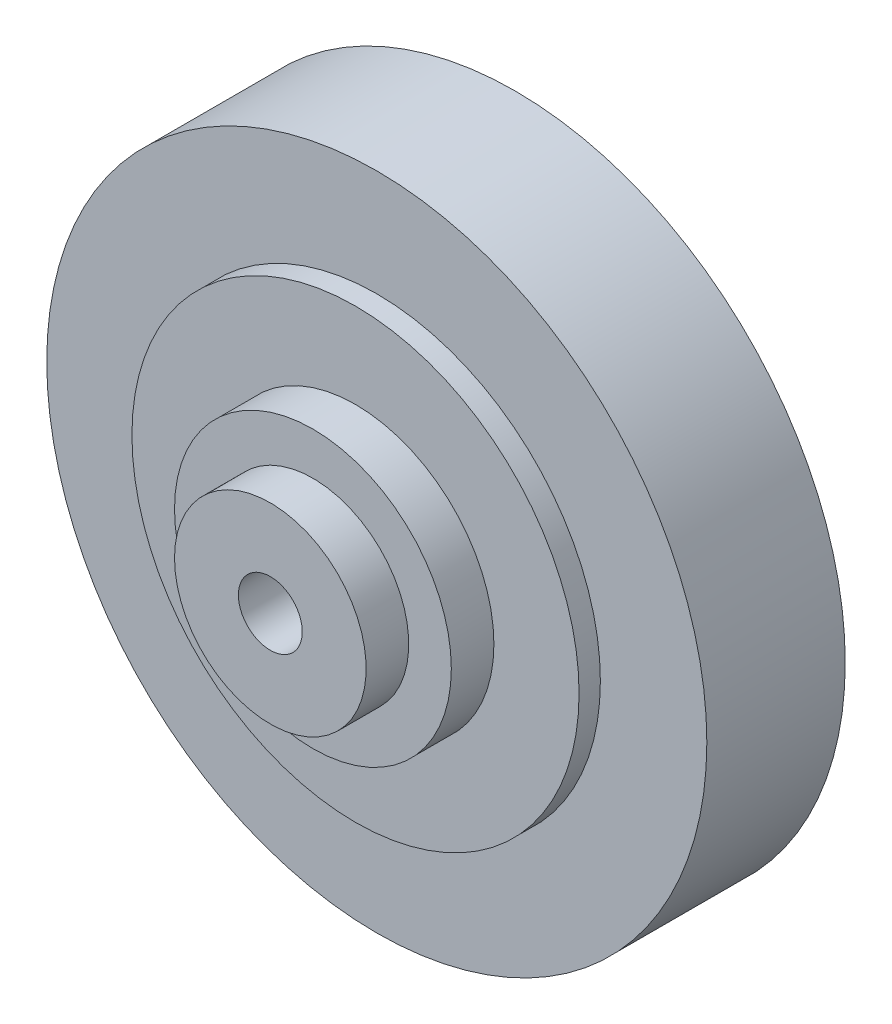
from build123d import *


with BuildPart() as part:
    # Croquis1 → Revolución1 (revolve)
    with BuildSketch(Plane(origin=(0, 0, 0), x_dir=(0, 0, -1), z_dir=(1, 0, 0)), mode=Mode.PRIVATE) as revoluci_n1_sk:
        Polygon((2, 3), (-23, 3), (-23, 9), (-19, 9), (-19, 13), (-15, 13), (-15, 21), (-13, 21), (-13, 31), (0, 31), (0, 30), (-11, 27), (-11, 10), (2, 10), align=None)
    revolve(revoluci_n1_sk.sketch.rotate(Axis((0, 0, 0), (0, 0, 1)), 90), axis=Axis((0, 0, 0), (0, 0, 1)))


solid = part.part
